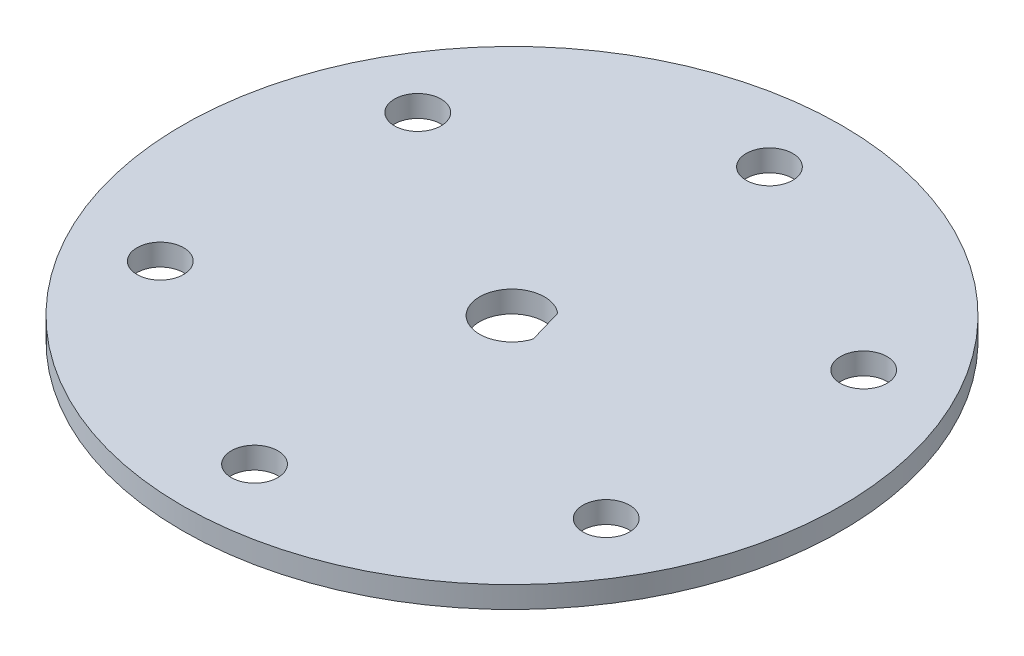
from build123d import *

# Parameters (mm, degrees)
SKETCH1_R           = 30.48
SKETCH1_R_2         = 2.15265
BOSS_EXTRUDE1_DEPTH = 2
CUT_EXTRUDE1_DEPTH  = 10


with BuildPart() as part:
    # Sketch1 → Boss-Extrude1 (new body)
    with BuildSketch(Plane(origin=(0, 0, 0), x_dir=(1, 0, 0), z_dir=(0, 1, 0))):
        with Locations(Location((0, 0, 0), (0, 0, 270))):
            Circle(SKETCH1_R)
        with Locations(Location((0, -23.8125, 0), (0, 0, 270))):
            Circle(SKETCH1_R_2, mode=Mode.SUBTRACT)
        with Locations(Location((20.622229928, -11.90625, 0), (0, 0, 270))):
            Circle(SKETCH1_R_2, mode=Mode.SUBTRACT)
        with Locations(Location((20.622229928, 11.90625, 0), (0, 0, 270))):
            Circle(SKETCH1_R_2, mode=Mode.SUBTRACT)
        with Locations(Location((0, 23.8125, 0), (0, 0, 270))):
            Circle(SKETCH1_R_2, mode=Mode.SUBTRACT)
        with Locations(Location((-20.622229928, 11.90625, 0), (0, 0, 270))):
            Circle(SKETCH1_R_2, mode=Mode.SUBTRACT)
        with Locations(Location((-20.622229928, -11.90625, 0), (0, 0, 270))):
            Circle(SKETCH1_R_2, mode=Mode.SUBTRACT)
    extrude(amount=BOSS_EXTRUDE1_DEPTH)

    # Sketch2 → Cut-Extrude1 (cut)
    with BuildSketch(Plane(origin=(0, 2, 0), x_dir=(1, 0, 0), z_dir=(0, 1, 0))):
        with BuildLine():
            ThreePointArc((1.93204455, 2.295038966), (-2.879237228, -0.842610814), (2.864533851, -0.8913169))
            Line((2.864533851, -0.8913169), (1.93204455, 2.295038966))
        make_face()
    extrude(amount=-CUT_EXTRUDE1_DEPTH, mode=Mode.SUBTRACT)


solid = part.part
